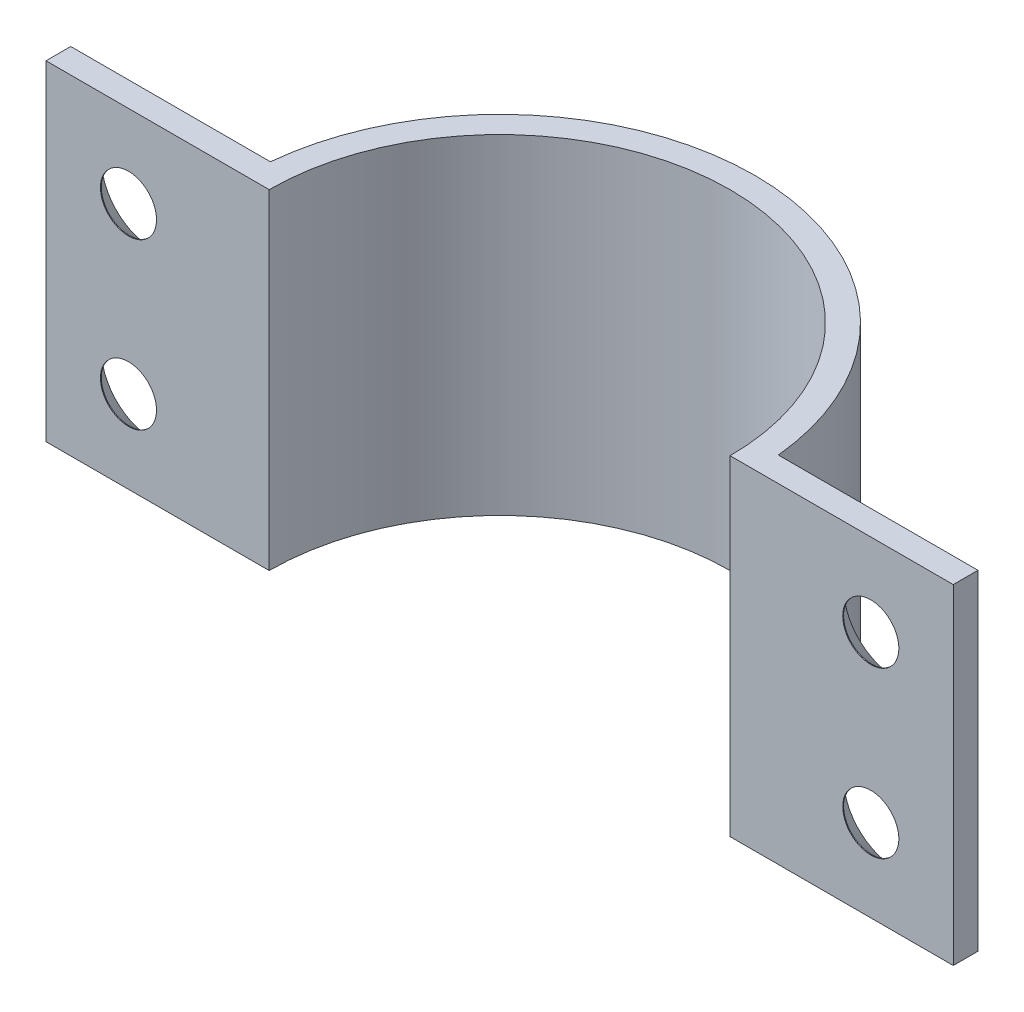
from build123d import *

# Parameters (mm, degrees)
BOSS_EXTRUDE1_DEPTH                          = 20
CSK_FOR_M3_COUNTERSUNK_FLAT_HEAD_SCR_2_COUNT = 2
CSK_FOR_M3_COUNTERSUNK_FLAT_HEAD_SCR_2_PITCH = 45
CSK_FOR_M3_COUNTERSUNK_FLAT_HEAD_SCR_3_COUNT = 2
CSK_FOR_M3_COUNTERSUNK_FLAT_HEAD_SCR_3_PITCH = 10
CSK_FOR_M3_COUNTERSUNK_FLAT_HEAD_SCR_4_COUNT = 2
CSK_FOR_M3_COUNTERSUNK_FLAT_HEAD_SCR_4_PITCH = 46.097722286


with BuildPart() as part:
    # Sketch1 → Boss-Extrude1 (new body)
    with BuildSketch(Plane(origin=(0, 0, 0), x_dir=(1, 0, 0), z_dir=(0, 1, 0))):
        with BuildLine():
            Line((-13.97, 0), (-27.5, 0))
            Line((-27.5, 0), (-27.5, 1.5))
            Line((-27.5, 1.5), (-15.397106871, 1.5))
            ThreePointArc((-15.397106871, 1.5), (0, 15.47), (15.397106871, 1.5))
            Line((15.397106871, 1.5), (27.5, 1.5))
            Line((27.5, 1.5), (27.5, 0))
            Line((27.5, 0), (13.97, 0))
            ThreePointArc((13.97, 0), (0, 13.97), (-13.97, 0))
        make_face()
    extrude(amount=BOSS_EXTRUDE1_DEPTH)

    # Sketch3 → CSK for M3 Countersunk Flat Head Screw1 (revolve, cut)
    with BuildSketch(Plane(origin=(22.5, 5, -1.5), x_dir=(0, 1, 0), z_dir=(1, 0, 0))):
        Polygon((0, 0), (0, 1.5), (1.7, 1.5), (1.7, 1.45), (3.15, 0), align=None)
    csk_for_m3_countersunk_flat_head_screw1 = revolve(axis=Axis((22.5, 5, -7.85), (0, 0, 1)), mode=Mode.SUBTRACT)

    # CSK for M3 Countersunk Flat Head Scr 2: CSK for M3 Countersunk Flat Head Screw1 ×2
    with Locations(*[(-i * CSK_FOR_M3_COUNTERSUNK_FLAT_HEAD_SCR_2_PITCH, 0, 0) for i in range(1, CSK_FOR_M3_COUNTERSUNK_FLAT_HEAD_SCR_2_COUNT)]):
        add(csk_for_m3_countersunk_flat_head_screw1, mode=Mode.SUBTRACT)

    # CSK for M3 Countersunk Flat Head Scr 3: CSK for M3 Countersunk Flat Head Screw1 ×2
    with Locations(*[(0, i * CSK_FOR_M3_COUNTERSUNK_FLAT_HEAD_SCR_3_PITCH, 0) for i in range(1, CSK_FOR_M3_COUNTERSUNK_FLAT_HEAD_SCR_3_COUNT)]):
        add(csk_for_m3_countersunk_flat_head_screw1, mode=Mode.SUBTRACT)

    # CSK for M3 Countersunk Flat Head Scr 4: CSK for M3 Countersunk Flat Head Screw1 ×2
    with Locations(*[Vector(-0.9761870601839527, 0.21693045781865616, 0) * (i * CSK_FOR_M3_COUNTERSUNK_FLAT_HEAD_SCR_4_PITCH) for i in range(1, CSK_FOR_M3_COUNTERSUNK_FLAT_HEAD_SCR_4_COUNT)]):
        add(csk_for_m3_countersunk_flat_head_screw1, mode=Mode.SUBTRACT)


solid = part.part
